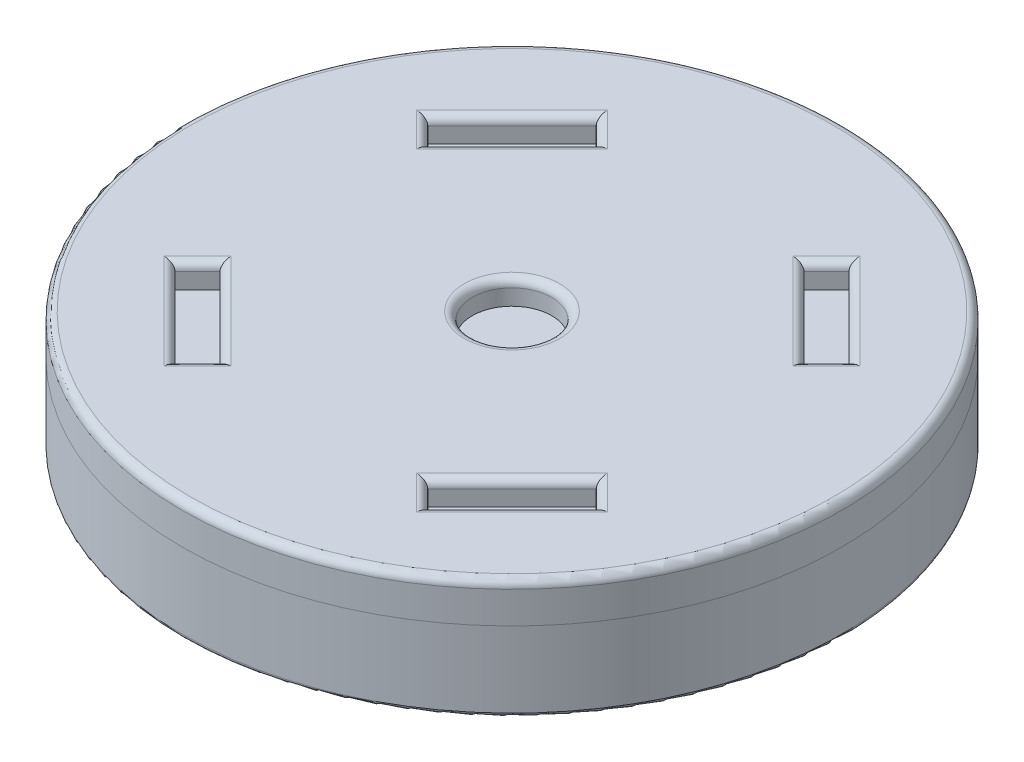
from build123d import *

# Parameters (mm, degrees)
SKETCH1_R           = 41.5
BOSS_EXTRUDE1_DEPTH = 10
SKETCH2_R           = 41.50000000000001
BOSS_EXTRUDE2_DEPTH = 5
SKETCH3_R           = 4.999999999999998
CUT_EXTRUDE1_DEPTH  = 3
FILLET1_R           = 1
FILLET2_R           = 0.5


with BuildPart() as part:
    # Sketch1 → Boss-Extrude1 (new body)
    with BuildSketch(Plane(origin=(0, 0, 0), x_dir=(1, 0, 0), z_dir=(0, 1, 0))):
        with Locations(Location((0, 0, 0), (0, 0, 270))):
            Circle(SKETCH1_R)
        with BuildLine():
            Line((28.999999999999996, 0), (28.999999999999993, 2.9999999999995133))
            Line((28.999999999999993, 2.9999999999995133), (24.330017156100897, 5.748936004499784))
            ThreePointArc((24.330017156100897, 5.748936004499784), (23.77641290737902, 7.7254248593729935), (23.06253715253842, 9.649838345163323))
            Line((23.06253715253842, 9.649838345163323), (25.224848593751084, 14.618721333356545))
            Line((25.224848593751084, 14.618721333356545), (23.461492836873695, 17.04577231648141))
            Line((23.461492836873695, 17.04577231648141), (21.698137079996076, 19.472823299606535))
            Line((21.698137079996076, 19.472823299606535), (16.304257552901607, 18.951812199593306))
            ThreePointArc((16.304257552901607, 18.951812199593306), (14.69463130731244, 20.22542485937331), (12.985951823513746, 21.3627024329176))
            Line((12.985951823513746, 21.3627024329176), (11.81466238575924, 26.65358798943447))
            Line((11.81466238575924, 26.65358798943447), (8.96149283687379, 27.58063897255935))
            Line((8.96149283687379, 27.58063897255935), (6.10832328798834, 28.50768995568422))
            Line((6.10832328798834, 28.50768995568422), (2.0508257258260114, 24.915740282847224))
            ThreePointArc((2.0508257258260114, 24.915740282847224), (7.1207e-13, 25.000000000000114), (-2.0508257258245957, 24.91574028284734))
            Line((-2.0508257258245957, 24.91574028284734), (-6.108323287987743, 28.507689955684352))
            Line((-6.108323287987743, 28.507689955684352), (-8.961492836873212, 27.580638972559537))
            Line((-8.961492836873212, 27.580638972559537), (-11.814662385758682, 26.653587989434723))
            Line((-11.814662385758682, 26.653587989434723), (-12.9859518235125, 21.362702432918404))
            ThreePointArc((-12.9859518235125, 21.362702432918404), (-14.694631307311308, 20.2254248593742), (-16.304257552900577, 18.95181219959425))
            Line((-16.304257552900577, 18.95181219959425), (-21.698137079995885, 19.472823299606752))
            Line((-21.698137079995885, 19.472823299606752), (-23.461492836873326, 17.045772316481926))
            Line((-23.461492836873326, 17.045772316481926), (-25.224848593750764, 14.6187213333571))
            Line((-25.224848593750764, 14.6187213333571), (-23.06253715253789, 9.649838345164753))
            ThreePointArc((-23.06253715253789, 9.649838345164753), (-23.776412907378663, 7.72542485937439), (-24.330017156100656, 5.748936004501123))
            Line((-24.330017156100656, 5.748936004501123), (-28.99999999999998, 3.0000000000002025))
            Line((-28.99999999999998, 3.0000000000002025), (-28.999999999999996, 2.0251e-13))
            Line((-28.999999999999996, 2.0251e-13), (-29.000000000000018, -2.9999999999997975))
            Line((-29.000000000000018, -2.9999999999997975), (-24.330017156100894, -5.7489360044997975))
            ThreePointArc((-24.330017156100894, -5.7489360044997975), (-23.77641290737902, -7.725424859372989), (-23.062537152538383, -9.649838345163285))
            Line((-23.062537152538383, -9.649838345163285), (-25.224848593750977, -14.618721333356735))
            Line((-25.224848593750977, -14.618721333356735), (-23.46149283687357, -17.04577231648159))
            Line((-23.46149283687357, -17.04577231648159), (-21.698137079996165, -19.47282329960644))
            Line((-21.698137079996165, -19.47282329960644), (-16.304257552901333, -18.951812199593302))
            ThreePointArc((-16.304257552901333, -18.951812199593302), (-14.694631307312347, -20.225424859373156), (-12.985951823513815, -21.362702432917306))
            Line((-12.985951823513815, -21.362702432917306), (-11.814662385759053, -26.653587989434566))
            Line((-11.814662385759053, -26.653587989434566), (-8.961492836873596, -27.58063897255942))
            Line((-8.961492836873596, -27.58063897255942), (-6.1083232879881395, -28.507689955684274))
            Line((-6.1083232879881395, -28.507689955684274), (-2.0508257258256974, -24.915740282846958))
            ThreePointArc((-2.0508257258256974, -24.915740282846958), (-7.2011e-13, -24.999999999999822), (2.0508257258242626, -24.91574028284707))
            Line((2.0508257258242626, -24.91574028284707), (6.108323287987934, -28.50768995568432))
            Line((6.108323287987934, -28.50768995568432), (8.961492836873399, -27.58063897255948))
            Line((8.961492836873399, -27.58063897255948), (11.814662385758863, -26.65358798943465))
            Line((11.814662385758863, -26.65358798943465), (12.985951823512602, -21.362702432918002))
            ThreePointArc((12.985951823512602, -21.362702432918002), (14.694631307311141, -20.22542485937396), (16.304257552900186, -18.951812199594233))
            Line((16.304257552900186, -18.951812199594233), (21.698137079995842, -19.472823299606855))
            Line((21.698137079995842, -19.472823299606855), (23.461492836873457, -17.04577231648176))
            Line((23.461492836873457, -17.04577231648176), (25.224848593750878, -14.618721333356914))
            Line((25.224848593750878, -14.618721333356914), (23.062537152537804, -9.64983834516451))
            ThreePointArc((23.062537152537804, -9.64983834516451), (23.77641290737852, -7.72542485937426), (24.33001715610064, -5.748936004501146))
            Line((24.33001715610064, -5.748936004501146), (28.999999999999993, -3.0000000000002123))
            Line((28.999999999999993, -3.0000000000002123), (28.999999999999996, 0))
        make_face(mode=Mode.SUBTRACT)
    extrude(amount=BOSS_EXTRUDE1_DEPTH)

    # Fillet2
    fillet2_edges = [part.edges().sort_by_distance(p)[0] for p in [
        (-5.72e-15, 0, -41.5),
        (23.77641290737902, 0, -7.725424859372993),
        (24.14369287314475, 0, -12.134279839259934),
        (23.461492836873582, 0, -17.04577231648154),
        (19.00119731644884, 0, -19.21231774959992),
        (14.694631307312441, 0, -20.225424859373305),
        (12.400307104636493, 0, -24.008145211176036),
        (8.96149283687379, 0, -27.580638972559345),
        (4.079574506907176, 0, -26.711715119265723),
        (7.1043e-13, 0, -25.00000000000011),
        (-4.0795745069061695, 0, -26.711715119265847),
        (-8.961492836873212, 0, -27.580638972559537),
        (-12.40030710463559, 0, -24.00814521117656),
        (-14.69463130731131, 0, -20.2254248593742),
        (-19.00119731644823, 0, -19.2123177496005),
        (-23.461492836873326, 0, -17.045772316481926),
        (-24.143692873144325, 0, -12.134279839260927),
        (-23.776412907378663, 0, -7.725424859374391),
        (-26.66500857805032, 0, -4.374468002250662),
        (-29, 0, -2.025e-13),
        (-26.665008578050454, 0, 4.374468002249797),
        (-23.77641290737902, 0, 7.725424859372989),
        (-24.14369287314468, 0, 12.13427983926001),
        (-23.46149283687357, 0, 17.04577231648159),
        (-19.00119731644875, 0, 19.21231774959987),
        (-14.694631307312342, 0, 20.225424859373163),
        (-12.400307104636434, 0, 24.008145211175936),
        (-8.961492836873596, 0, 27.58063897255942),
        (-4.079574506906918, 0, 26.711715119265616),
        (-7.2042e-13, 0, 24.99999999999983),
        (4.0795745069060985, 0, 26.711715119265698),
        (8.961492836873399, 0, 27.580638972559488),
        (12.400307104635733, 0, 24.008145211176327),
        (14.694631307311141, 0, 20.22542485937396),
        (19.001197316448014, 0, 19.212317749600544),
        (23.46149283687336, 0, 17.045772316481884),
        (24.14369287314434, 0, 12.134279839260712),
        (23.77641290737852, 0, 7.725424859374257),
        (26.66500857805032, 0, 4.374468002250679),
        (28.999999999999993, 0, 3.495e-13),
        (26.665008578050447, 0, -4.374468002249649),
    ]]
    fillet(fillet2_edges, radius=FILLET2_R)


with BuildPart() as body_2:
    # Sketch2 → Boss-Extrude2 (new body)
    with BuildSketch(Plane(origin=(0, 10, 0), x_dir=(1, 0, 0), z_dir=(0, 1, 0))):
        with Locations(Location((0, 0, 0), (0, 0, 270))):
            Circle(SKETCH2_R)
    extrude(amount=BOSS_EXTRUDE2_DEPTH)

    # Sketch3 → Cut-Extrude1 (cut)
    with BuildSketch(Plane(origin=(0, 15, 0), x_dir=(1, 0, 0), z_dir=(0, 1, 0))):
        with Locations(Location((-4.3e-16, 1.3e-15, 0), (0, 0, 270))):
            Circle(SKETCH3_R)
        Polygon((-21.213203435596423, 21.213203435596423), (-26.51650429449553, 15.909902576697318), (-23.688077169749338, 13.081475451951126), (-13.081475451951125, 23.688077169749334), (-15.909902576697318, 26.516504294495533), align=None)
        Polygon((23.68807716974938, 13.081475451951034), (13.08147545195121, 23.688077169749285), (15.909902576697412, 26.516504294495466), (21.213203435596498, 21.213203435596345), (26.516504294495586, 15.909902576697219), align=None)
        Polygon((13.081475451950963, -23.688077169749423), (23.688077169749253, -13.081475451951292), (26.51650429449542, -15.909902576697503), (21.213203435596277, -21.213203435596572), (15.909902576697139, -26.516504294495643), align=None)
        Polygon((-23.68807716974947, -13.081475451950878), (-13.081475451951373, -23.688077169749203), (-15.909902576697482, -26.516504294495252), (-21.213203435596647, -21.213203435596206), (-26.5165042944957, -15.909902576697041), align=None)
    extrude(amount=-CUT_EXTRUDE1_DEPTH, mode=Mode.SUBTRACT)

    # Fillet1
    fillet1_edges = [body_2.edges().sort_by_distance(p)[0] for p in [
        (-21.21320343559659, 15, 21.213203435596146),
        (-14.495689014324427, 15, 25.102290732122228),
        (-18.38477631085042, 15, 18.38477631085004),
        (-25.102290732122583, 15, 14.49568901432396),
        (21.213203435596277, 15, 21.213203435596572),
        (25.102290732122334, 15, 14.495689014324398),
        (18.384776310850107, 15, 18.384776310850356),
        (14.49568901432405, 15, 25.102290732122533),
        (21.213203435596498, 15, -21.21320343559634),
        (14.495689014324311, 15, -25.102290732122377),
        (18.384776310850295, 15, -18.38477631085016),
        (25.102290732122484, 15, -14.495689014324126),
        (-14.49568901432422, 15, -25.102290732122434),
        (-21.213203435596423, 15, -21.213203435596427),
        (-25.102290732122434, 15, -14.495689014324222),
        (-18.38477631085023, 15, -18.38477631085023),
        (1.1e-15, 15, -4.999999999999999),
        (3.114e-14, 15, -41.50000000000001),
    ]]
    fillet(fillet1_edges, radius=FILLET1_R)


solid = Compound([part.part, body_2.part])
